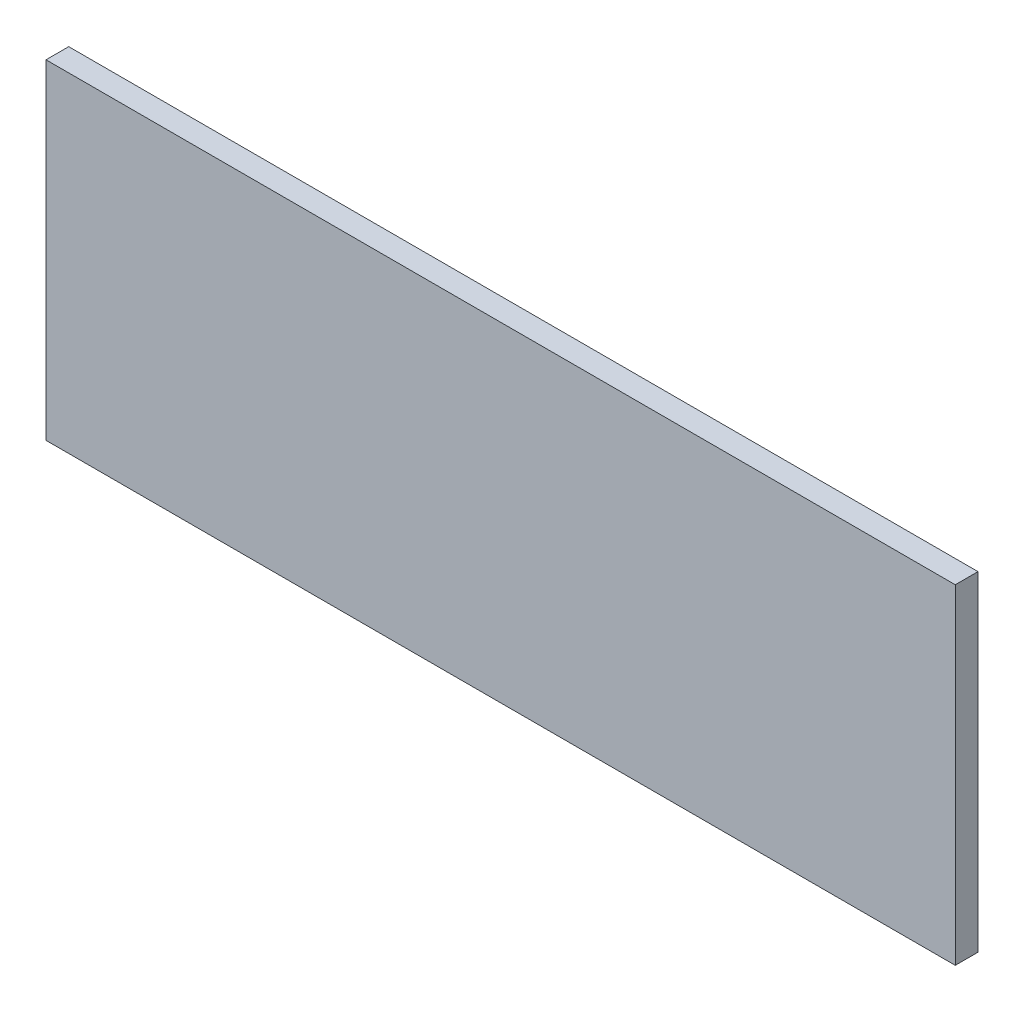
from build123d import *

# Parameters (mm, degrees)
SKETCH_1_W      = 80
SKETCH_1_H      = 29
EXTRUDE_1_DEPTH = 2


with BuildPart() as part:
    # 草图1 → 凸台-拉伸1 (new body)
    with BuildSketch(Plane.XY):
        with Locations((40, 14.5)):
            Rectangle(SKETCH_1_W, SKETCH_1_H)
    extrude(amount=EXTRUDE_1_DEPTH)


solid = part.part
